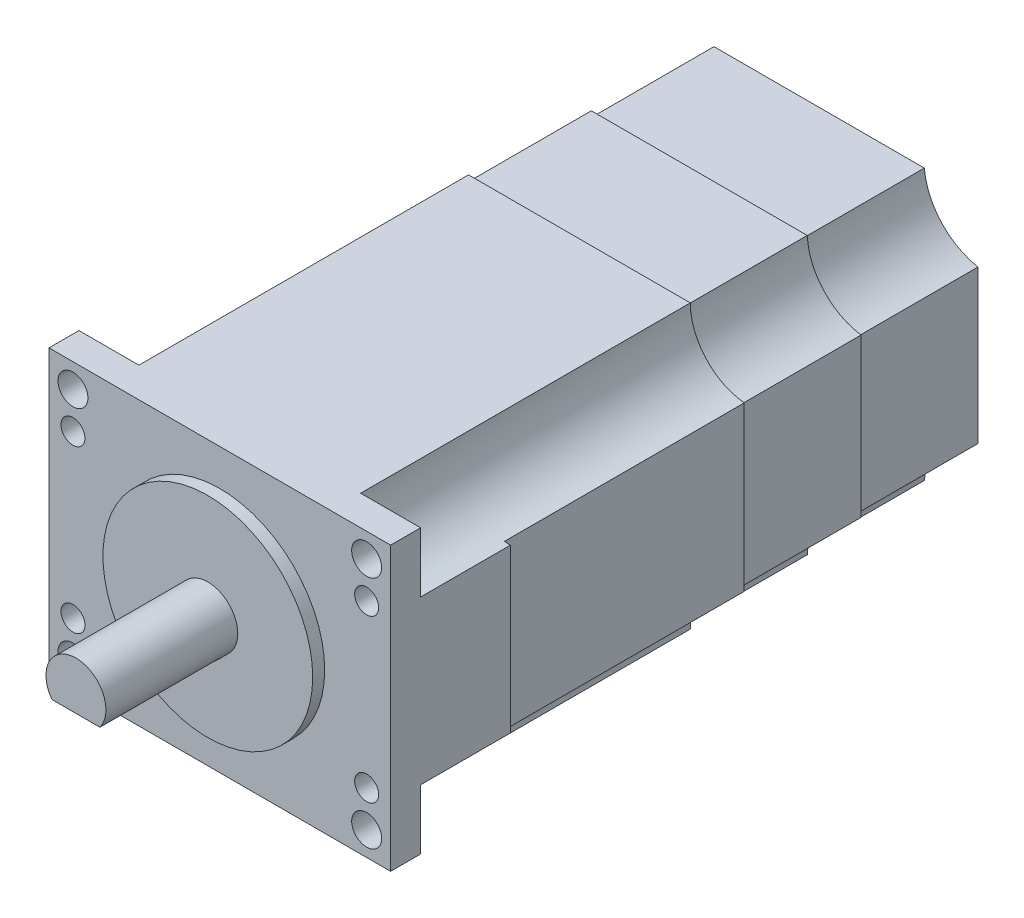
from build123d import *

# Parameters (mm, degrees)
SKETCH_2_W           = 57
SKETCH_2_H           = 47.14
EXTRUDE_1_DEPTH      = 100
SKETCH_3_R           = 17.5
EXTRUDE_2_DEPTH      = 2
SKETCH_4_R           = 5
EXTRUDE_3_DEPTH      = 22
SKETCH_5_W           = 15.396782634
SKETCH_5_H           = 5.477116352
CUT_EXTRUDE_1_DEPTH  = 20
SKETCH_7_R           = 10
CUT_EXTRUDE_2_DEPTH  = 95
SKETCH_8_R           = 2.5
CUT_EXTRUDE_3_DEPTH  = 90
SKETCH_9_OUTSIDE_W   = 87.878
SKETCH_9_OUTSIDE_H   = 78.018
SKETCH_9_OUTSIDE_W_2 = 55
SKETCH_9_OUTSIDE_H_2 = 47.14
CUT_EXTRUDE_4_DEPTH  = 80
CUT_EXTRUDE_5_DEPTH  = 40
CUT_EXTRUDE_6_DEPTH  = 20
SKETCH_12_R          = 2
CUT_EXTRUDE_7_DEPTH  = 4


with BuildPart() as part:
    # 草图2 → 凸台-拉伸1 (new body)
    with BuildSketch(Plane.XY):
        Rectangle(SKETCH_2_W, SKETCH_2_H)
    extrude(amount=EXTRUDE_1_DEPTH)

    # 草图3 → 凸台-拉伸2 (add)
    with BuildSketch(Plane.XY.offset(100)):
        Circle(SKETCH_3_R)
    extrude(amount=EXTRUDE_2_DEPTH)

    # 草图4 → 凸台-拉伸3 (add)
    with BuildSketch(Plane.XY.offset(102)):
        Circle(SKETCH_4_R)
    extrude(amount=EXTRUDE_3_DEPTH)

    # 草图5 → 切除-拉伸1 (cut)
    with BuildSketch(Plane.XY.offset(124)):
        with Locations((0.517283211, -5.738558176)):
            Rectangle(SKETCH_5_W, SKETCH_5_H)
    extrude(amount=-CUT_EXTRUDE_1_DEPTH, mode=Mode.SUBTRACT)

    # 草图7 → 切除-拉伸2 (cut)
    with BuildSketch(Plane(origin=(0, 0, 0), x_dir=(-1, 0, 0), z_dir=(0, 0, -1))):
        with Locations((28.5, 23.57)):
            Circle(SKETCH_7_R)
        with Locations((28.5, -23.57)):
            Circle(SKETCH_7_R)
        with Locations((-28.5, -23.57)):
            Circle(SKETCH_7_R)
        with Locations((-28.5, 23.57)):
            Circle(SKETCH_7_R)
    extrude(amount=-CUT_EXTRUDE_2_DEPTH, mode=Mode.SUBTRACT)

    # 草图8 → 切除-拉伸3 (cut)
    with BuildSketch(Plane.XY.offset(100)):
        with Locations((-24.5, 19.57)):
            Circle(SKETCH_8_R)
        with Locations((24.5, 19.57)):
            Circle(SKETCH_8_R)
        with Locations((24.5, -19.57)):
            Circle(SKETCH_8_R)
        with Locations((-24.5, -19.57)):
            Circle(SKETCH_8_R)
    extrude(amount=-CUT_EXTRUDE_3_DEPTH, mode=Mode.SUBTRACT)

    # 草图9 outside → 切除-拉伸4 (cut)
    with BuildSketch(Plane(origin=(0, 0, 0), x_dir=(-1, 0, 0), z_dir=(0, 0, -1))):
        Rectangle(SKETCH_9_OUTSIDE_W, SKETCH_9_OUTSIDE_H)
        Rectangle(SKETCH_9_OUTSIDE_W_2, SKETCH_9_OUTSIDE_H_2, mode=Mode.SUBTRACT)
    extrude(amount=-CUT_EXTRUDE_4_DEPTH, mode=Mode.SUBTRACT)

    # 草图10 → 切除-拉伸5 (cut)
    with BuildSketch(Plane(origin=(0, 0, 0), x_dir=(-1, 0, 0), z_dir=(0, 0, -1))):
        with BuildLine():
            Line((-27.5, 13.620125629), (-27.5, -13.620125629))
            ThreePointArc((-27.5, -13.620125629), (-21.083801513, -16.861796068), (-18.5, -23.57))
            Line((-18.5, -23.57), (18.5, -23.57))
            ThreePointArc((18.5, -23.57), (21.083801513, -16.861796068), (27.5, -13.620125629))
            Line((27.5, -13.620125629), (27.5, 13.620125629))
            ThreePointArc((27.5, 13.620125629), (21.083801513, 16.861796068), (18.5, 23.57))
            Line((18.5, 23.57), (-18.5, 23.57))
            ThreePointArc((-18.5, 23.57), (-21.083801513, 16.861796068), (-27.5, 13.620125629))
        make_face()
        with BuildLine():
            Line((-27, 13.177695155), (-27, -13.177695155))
            ThreePointArc((-27, -13.177695155), (-20.728707305, -16.509050358), (-18.011911518, -23.07))
            Line((-18.011911518, -23.07), (18.011911518, -23.07))
            ThreePointArc((18.011911518, -23.07), (20.728707305, -16.509050358), (27, -13.177695155))
            Line((27, -13.177695155), (27, 13.177695155))
            ThreePointArc((27, 13.177695155), (20.728707305, 16.509050358), (18.011911518, 23.07))
            Line((18.011911518, 23.07), (-18.011911518, 23.07))
            ThreePointArc((-18.011911518, 23.07), (-20.728707305, 16.509050358), (-27, 13.177695155))
        make_face(mode=Mode.SUBTRACT)
    extrude(amount=-CUT_EXTRUDE_5_DEPTH, mode=Mode.SUBTRACT)

    # 草图11 → 切除-拉伸6 (cut)
    with BuildSketch(Plane(origin=(0, 0, 0), x_dir=(-1, 0, 0), z_dir=(0, 0, -1))):
        with BuildLine():
            Line((-27, 13.177695155), (-27, -13.177695155))
            ThreePointArc((-27, -13.177695155), (-20.728707305, -16.509050358), (-18.011911518, -23.07))
            Line((-18.011911518, -23.07), (18.011911518, -23.07))
            ThreePointArc((18.011911518, -23.07), (20.728707305, -16.509050358), (27, -13.177695155))
            Line((27, -13.177695155), (27, 13.177695155))
            ThreePointArc((27, 13.177695155), (20.728707305, 16.509050358), (18.011911518, 23.07))
            Line((18.011911518, 23.07), (-18.011911518, 23.07))
            ThreePointArc((-18.011911518, 23.07), (-20.728707305, 16.509050358), (-27, 13.177695155))
        make_face()
        with BuildLine():
            Line((17.54554885, 22.57), (-17.54554885, 22.57))
            ThreePointArc((-17.54554885, 22.57), (-20.373123341, 16.156911861), (-26.5, 12.753346174))
            Line((-26.5, 12.753346174), (-26.5, -12.753346174))
            ThreePointArc((-26.5, -12.753346174), (-20.373123341, -16.156911861), (-17.54554885, -22.57))
            Line((-17.54554885, -22.57), (17.54554885, -22.57))
            ThreePointArc((17.54554885, -22.57), (20.373123341, -16.156911861), (26.5, -12.753346174))
            Line((26.5, -12.753346174), (26.5, 12.753346174))
            ThreePointArc((26.5, 12.753346174), (20.373123341, 16.156911861), (17.54554885, 22.57))
        make_face(mode=Mode.SUBTRACT)
    extrude(amount=-CUT_EXTRUDE_6_DEPTH, mode=Mode.SUBTRACT)

    # 草图12 → 切除-拉伸7 (cut)
    with BuildSketch(Plane.XY.offset(100)):
        with Locations((-24.5, 13.5)):
            Circle(SKETCH_12_R)
        with Locations((-24.5, -13.5)):
            Circle(SKETCH_12_R)
        with Locations((24.5, -13.5)):
            Circle(SKETCH_12_R)
        with Locations((24.5, 13.5)):
            Circle(SKETCH_12_R)
    extrude(amount=-CUT_EXTRUDE_7_DEPTH, mode=Mode.SUBTRACT)


solid = part.part
